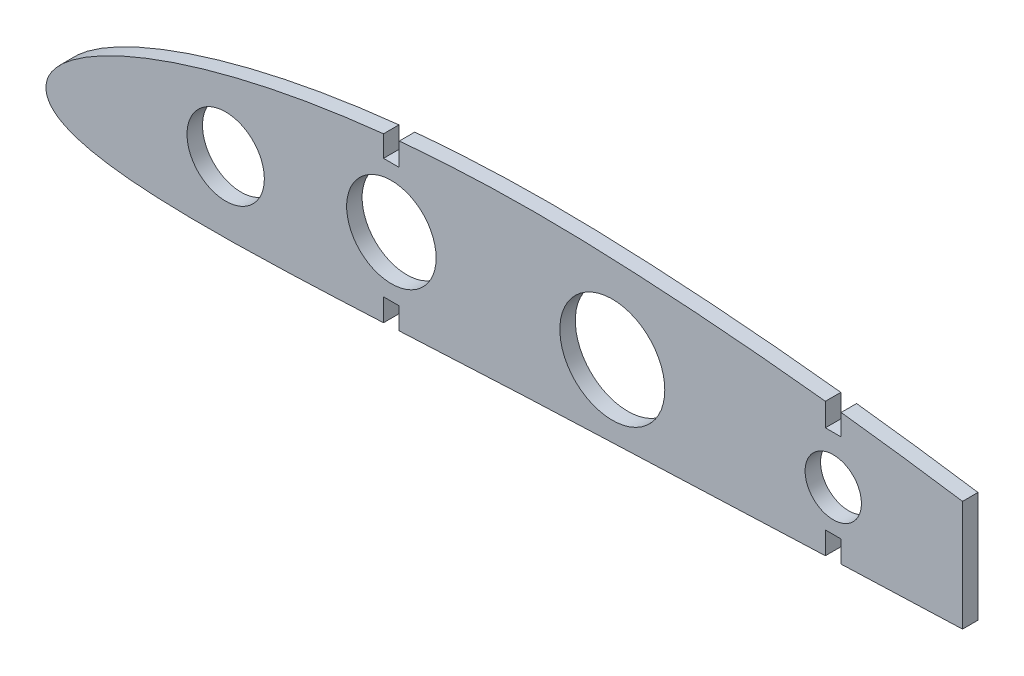
from build123d import *

# Parameters (mm, degrees)
SKETCH_1_R      = 7
SKETCH_1_R_2    = 8.1
SKETCH_1_R_3    = 9.5
SKETCH_1_R_4    = 5.1
EXTRUDE_1_DEPTH = 1.4


with BuildPart() as part:
    # Эскиз1 → Бобышка-Вытянуть1 (new, symmetric)
    with BuildSketch(Plane.XY):
        with BuildLine():
            Line((63.957619318, 19.450139662), (61.107619318, 19.450139662))
            Line((61.107619318, 19.450139662), (61.107619318, 23.303137173))
            add(Edge.make_bspline(
                [(61.107619318, 23.303137173), (59.917945614, 23.176751945), (56.739740439, 22.81448979), (51.605762688, 22.119065522), (45.744400311, 21.156564432), (39.995857594, 20.03537139), (34.397919842, 18.756316235), (29.010382103, 17.327615608), (23.925798408, 15.771864922), (19.27067884, 14.134269435), (15.179098391, 12.483335438), (11.74047579, 10.895610996), (8.959371869, 9.429577366), (6.76089118, 8.1086032), (5.033709748, 6.924638056), (3.671694933, 5.854229665), (2.592101123, 4.871305369), (1.738175668, 3.952595744), (1.06987083, 3.080946374), (0.57164541, 2.241622103), (0.215773899, 1.430785398), (0.102255581, 0.883241695), (0.047975, 0.621425001)],
                knots=[0.740090669, 0.740090669, 0.740090669, 0.740090669, 0.7539832, 0.77723469, 0.800246382, 0.822950709, 0.845237155, 0.866915896, 0.887662335, 0.906968281, 0.924203157, 0.938878975, 0.950931611, 0.960693484, 0.968646729, 0.975232933, 0.980794744, 0.985583761, 0.989781539, 0.993521313, 0.996902113, 1, 1, 1, 1], degree=3))
            add(Edge.make_bspline(
                [(0.047975, 0.621425001), (0.02271382, 0.373490086), (-0.027820789, -0.122499974), (0.077991212, -0.884434589), (0.34969565, -1.63883807), (0.814331135, -2.365068923), (1.46348078, -3.039275244), (2.290973016, -3.660999469), (3.30592875, -4.23577962), (4.535255619, -4.773674143), (6.029745688, -5.282192164), (7.868981215, -5.765316676), (10.168831391, -6.221716592), (13.075438188, -6.63961873), (16.728115362, -6.992956737), (21.189952096, -7.247345144), (26.399984415, -7.376638848), (32.197398564, -7.376256913), (38.397806759, -7.261436579), (44.857621768, -7.056641358), (51.486543096, -6.786453532), (56.920566709, -6.533358441), (60.139839208, -6.376114839), (61.107619318, -6.32836923)],
                knots=[0, 0, 0, 0, 0.002941446, 0.005884319, 0.00901613, 0.012364547, 0.016007934, 0.020036845, 0.024573728, 0.029783835, 0.03589701, 0.04324044, 0.052275965, 0.063634589, 0.077983176, 0.095698161, 0.116520086, 0.13966073, 0.16431217, 0.18991889, 0.216157201, 0.242837762, 0.254306514, 0.254306514, 0.254306514, 0.254306514], degree=3))
            Line((61.107619318, -6.32836923), (61.107619318, -2.257745247))
            Line((61.107619318, -2.257745247), (63.957619318, -2.257745247))
            Line((63.957619318, -2.257745247), (63.957619318, -6.186566126))
            add(Edge.make_bspline(
                [(63.957619318, -6.186566126), (64.317823095, -6.168514758), (66.969747676, -6.035316313), (71.910772709, -5.784005174), (78.771375576, -5.439680449), (85.610498609, -5.110951246), (92.432107589, -4.804953317), (99.25503119, -4.531981644), (106.097378404, -4.278274658), (112.96921168, -4.00308991), (119.864404254, -3.723176166), (126.773860473, -3.440067276), (133.855552455, -3.151608468), (138.633361552, -2.960411351), (141.107619318, -2.86287629)],
                knots=[0.265564796, 0.265564796, 0.265564796, 0.265564796, 0.269833583, 0.296993022, 0.324123272, 0.351139107, 0.378035509, 0.404946016, 0.431960837, 0.459078395, 0.4863474, 0.51364083, 0.540928595, 0.570237104, 0.570237104, 0.570237104, 0.570237104], degree=3))
            Line((141.107619318, -2.86287629), (141.107619318, 1.193130543))
            Line((141.107619318, 1.193130543), (143.957619318, 1.193130543))
            Line((143.957619318, 1.193130543), (143.957619318, -2.751209627))
            add(Edge.make_bspline(
                [(143.957619318, -2.751209627), (145.13020609, -2.705557458), (148.596084852, -2.571725453), (154.352602411, -2.355626415), (160.507662095, -2.135075484), (164.369425992, -2.00299999), (165.940456932, -1.950382964)],
                knots=[0.581490104, 0.581490104, 0.581490104, 0.581490104, 0.595379569, 0.622543445, 0.64967326, 0.668278692, 0.668278692, 0.668278692, 0.668278692], degree=3))
            Line((165.940456932, -1.950382964), (165.940456932, 7.49391084))
            Line((165.940456932, 7.49391084), (165.940456932, 18.08535451))
            add(Edge.make_bspline(
                [(165.940456932, 18.08535451), (165.930512987, 18.08685322), (163.740114226, 18.416932974), (159.368680729, 19.054501815), (152.821805128, 19.944885603), (147.683892721, 20.591912914), (144.728786809, 20.943344409), (143.957619318, 21.033629847)],
                knots=[0.332761263, 0.332761263, 0.332761263, 0.332761263, 0.332878042, 0.358484538, 0.384061186, 0.409602822, 0.418619192, 0.418619192, 0.418619192, 0.418619192], degree=3))
            Line((143.957619318, 21.033629847), (143.957619318, 17.19883932))
            Line((143.957619318, 17.19883932), (141.107619318, 17.19883932))
            Line((141.107619318, 17.19883932), (141.107619318, 21.360787161))
            add(Edge.make_bspline(
                [(141.107619318, 21.360787161), (140.647203073, 21.412583326), (138.008124909, 21.706530989), (133.19183673, 22.212004255), (126.658683026, 22.825721434), (120.136770918, 23.363973271), (113.62856714, 23.824677329), (107.152732037, 24.200242598), (100.741095693, 24.498399513), (94.411752715, 24.686649771), (88.155917993, 24.740095652), (81.949043055, 24.658849145), (75.780520591, 24.441013809), (69.785413798, 24.089605746), (65.850842722, 23.766532071), (63.957619318, 23.588464287)],
                knots=[0.429723551, 0.429723551, 0.429723551, 0.429723551, 0.435103874, 0.460559416, 0.485959195, 0.51130307, 0.536551515, 0.561723366, 0.586628867, 0.611085431, 0.6352512, 0.659272176, 0.683163753, 0.706922144, 0.729003809, 0.729003809, 0.729003809, 0.729003809], degree=3))
            Line((63.957619318, 23.588464287), (63.957619318, 19.450139662))
        make_face()
        with Locations((32.532619318, 5.448144701)):
            Circle(SKETCH_1_R, mode=Mode.SUBTRACT)
        with Locations((62.532619318, 8.596197208)):
            Circle(SKETCH_1_R_2, mode=Mode.SUBTRACT)
        with Locations((102.532619318, 8.596197208)):
            Circle(SKETCH_1_R_3, mode=Mode.SUBTRACT)
        with Locations((142.532619318, 8.596197208)):
            Circle(SKETCH_1_R_4, mode=Mode.SUBTRACT)
    extrude(amount=EXTRUDE_1_DEPTH, both=True)


solid = part.part
